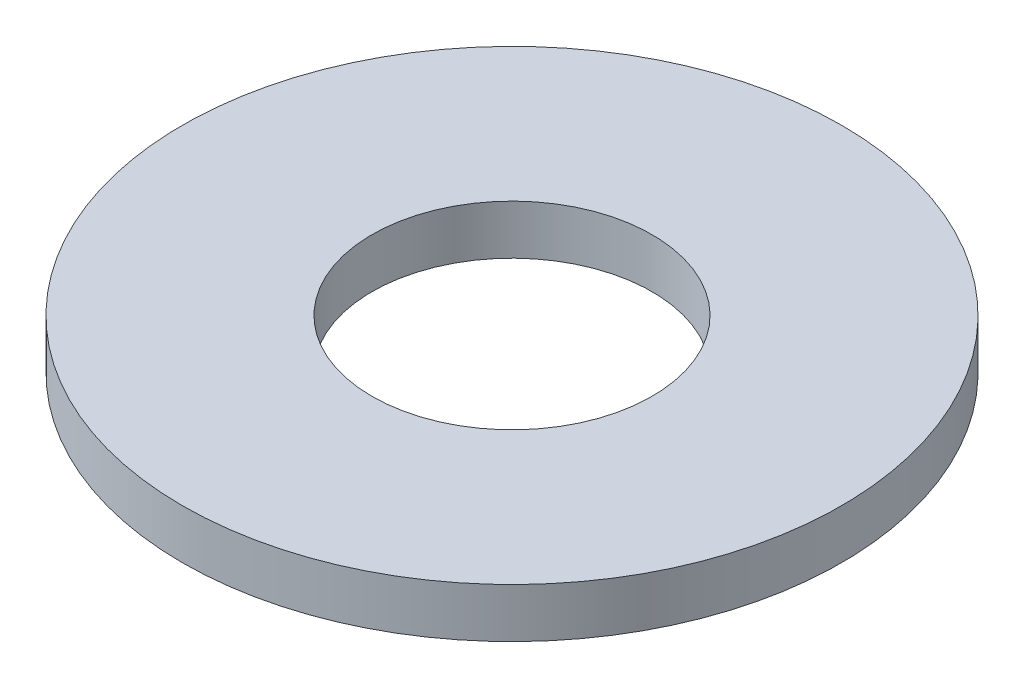
from build123d import *

# Parameters (mm, degrees)
SKETCH1_R           = 40
SKETCH1_R_2         = 17
BOSS_EXTRUDE1_DEPTH = 6


with BuildPart() as part:
    # Sketch1 → Boss-Extrude1 (new body)
    with BuildSketch(Plane(origin=(0, 0, 0), x_dir=(1, 0, 0), z_dir=(0, 1, 0))):
        with Locations(Location((0, 0, 0), (0, 0, 270))):
            Circle(SKETCH1_R)
        with Locations(Location((0, 0, 0), (0, 0, 270))):
            Circle(SKETCH1_R_2, mode=Mode.SUBTRACT)
    extrude(amount=BOSS_EXTRUDE1_DEPTH)


solid = part.part
